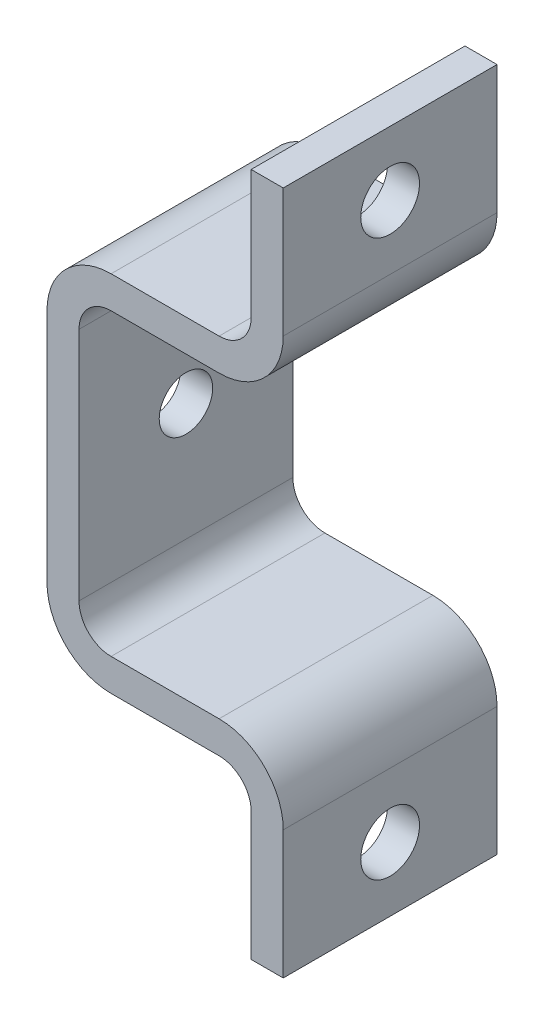
from build123d import *

# Parameters (mm, degrees)
BOSS_EXTRUDE1_DEPTH        = 10
FILLET1_R                  = 3
FILLET2_R                  = 6
SKETCH3_R                  = 2.5
CUT_EXTRUDE1_DEPTH         = 41.154825364
F_5_5_5_5_DIAMETER_HOLE1_D = 5.5


with BuildPart() as part:
    # Sketch1 → Boss-Extrude1 (new, symmetric)
    with BuildSketch(Plane.XY):
        Polygon((0, -17), (0, 17), (19.1, 17), (19.1, 32), (22.1, 32), (22.1, 14), (3, 14), (3, -14), (22.1, -14), (22.1, -32), (19.1, -32), (19.1, -17), align=None)
    extrude(amount=BOSS_EXTRUDE1_DEPTH, both=True)

    # Fillet1
    fillet1_edges = [part.edges().sort_by_distance(p)[0] for p in [
        (3, -14, 0),
        (19.1, -17, 0),
        (19.1, 17, 0),
        (3, 14, 0),
    ]]
    fillet(fillet1_edges, radius=FILLET1_R)

    # Fillet2
    fillet2_edges = [part.edges().sort_by_distance(p)[0] for p in [
        (22.1, -14, 0),
        (0, -17, 0),
        (0, 17, 0),
        (22.1, 14, 0),
    ]]
    fillet(fillet2_edges, radius=FILLET2_R)

    # Sketch3 → Cut-Extrude1 (cut, through all)
    with BuildSketch(Plane.ZY):
        Circle(SKETCH3_R)
    extrude(amount=-CUT_EXTRUDE1_DEPTH, mode=Mode.SUBTRACT)

    # Ø5.5 (5.5) Diameter Hole1 (through all)
    with Locations(Plane.ZY):
        with Locations((0, 26), (0, -26)):
            Hole(F_5_5_5_5_DIAMETER_HOLE1_D / 2)


solid = part.part
